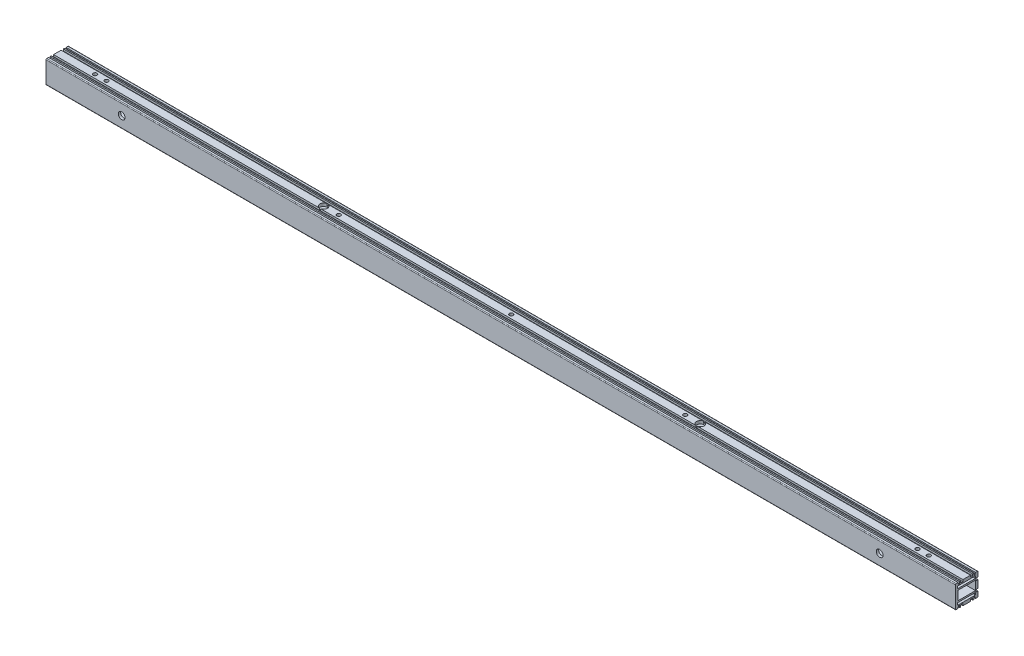
from build123d import *

# Parameters (mm, degrees)
SKETCH_1_W             = 23.5
SKETCH_1_H             = 12
EXTRUDE_1_DEPTH        = 601
HOLE_WIZARD_M6_1_D     = 5
HOLE_WIZARD_M6_1_DEPTH = 15
HOLE_WIZARD_M6_1_TIP   = 1.502151548
HOLE_WIZARD_M6_2_D     = 5
HOLE_WIZARD_M6_2_DEPTH = 15
HOLE_WIZARD_M6_2_TIP   = 1.502151548
SKETCH_8_R             = 4.5
CUT_EXTRUDE_1_DEPTH    = 602.935212461
HOLE_WIZARD_M6_3_D     = 5
HOLE_WIZARD_M6_3_DEPTH = 15
HOLE_WIZARD_M6_3_TIP   = 1.502151548
SKETCH_10_R            = 5.05
CUT_EXTRUDE_15_DEPTH   = 602.935212461
SKETCH_13_R            = 4.5
CUT_EXTRUDE_16_DEPTH   = 15
HOLE_WIZARD_M6_4_D     = 5
HOLE_WIZARD_M6_4_DEPTH = 15
HOLE_WIZARD_M6_4_TIP   = 1.502151548
HOLE_WIZARD_M6_5_D     = 5
HOLE_WIZARD_M6_5_DEPTH = 15
HOLE_WIZARD_M6_5_TIP   = 1.502151548


with BuildPart() as part:
    # 草图1 → 凸台-拉伸1 (new, symmetric)
    with BuildSketch(Plane(origin=(0, 0, 0), x_dir=(0, 0, -1), z_dir=(1, 0, 0))):
        with BuildLine():
            Line((-14, 15), (-11.5, 15))
            Line((-11.5, 15), (-11.5, 13.5))
            Line((-11.5, 13.5), (-11.4, 13.5))
            ThreePointArc((-11.4, 13.5), (-11.117157288, 13.382842712), (-11, 13.1))
            Line((-11, 13.1), (-11, 12))
            Line((-11, 12), (-9.5, 12))
            Line((-9.5, 12), (-9.5, 15))
            Line((-9.5, 15), (-8, 15))
            Line((-8, 15), (-8, 12.5))
            Line((-8, 12.5), (-5, 12.5))
            Line((-5, 12.5), (-5, 15))
            Line((-5, 15), (5, 15))
            Line((5, 15), (5, 12.5))
            Line((5, 12.5), (8, 12.5))
            Line((8, 12.5), (8, 15))
            Line((8, 15), (9.5, 15))
            Line((9.5, 15), (9.5, 12))
            Line((9.5, 12), (11, 12))
            Line((11, 12), (11, 13.1))
            ThreePointArc((11, 13.1), (11.117157288, 13.382842712), (11.4, 13.5))
            Line((11.4, 13.5), (11.5, 13.5))
            Line((11.5, 13.5), (11.5, 15))
            Line((11.5, 15), (14, 15))
            ThreePointArc((14, 15), (14.707106781, 14.707106781), (15, 14))
            Line((15, 14), (15, 8))
            Line((15, 8), (12.5, 8))
            Line((12.5, 8), (12.5, 5))
            Line((12.5, 5), (15, 5))
            Line((15, 5), (15, -5))
            Line((15, -5), (12.5, -5))
            Line((12.5, -5), (12.5, -8))
            Line((12.5, -8), (15, -8))
            Line((15, -8), (15, -14))
            ThreePointArc((15, -14), (14.707106781, -14.707106781), (14, -15))
            Line((14, -15), (11.5, -15))
            Line((11.5, -15), (11.5, -13.5))
            Line((11.5, -13.5), (11.4, -13.5))
            ThreePointArc((11.4, -13.5), (11.117157288, -13.382842712), (11, -13.1))
            Line((11, -13.1), (11, -12))
            Line((11, -12), (9.5, -12))
            Line((9.5, -12), (9.5, -15))
            Line((9.5, -15), (8, -15))
            Line((8, -15), (8, -12.5))
            Line((8, -12.5), (5, -12.5))
            Line((5, -12.5), (5, -15))
            Line((5, -15), (-5, -15))
            Line((-5, -15), (-5, -12.5))
            Line((-5, -12.5), (-8, -12.5))
            Line((-8, -12.5), (-8, -15))
            Line((-8, -15), (-9.5, -15))
            Line((-9.5, -15), (-9.5, -12))
            Line((-9.5, -12), (-11, -12))
            Line((-11, -12), (-11, -13.1))
            ThreePointArc((-11, -13.1), (-11.117157288, -13.382842712), (-11.4, -13.5))
            Line((-11.4, -13.5), (-11.5, -13.5))
            Line((-11.5, -13.5), (-11.5, -15))
            Line((-11.5, -15), (-14, -15))
            ThreePointArc((-14, -15), (-14.707106781, -14.707106781), (-15, -14))
            Line((-15, -14), (-15, 14))
            ThreePointArc((-15, 14), (-14.707106781, 14.707106781), (-14, 15))
        make_face()
        with BuildLine():
            Line((12, -10.5), (12, -8.5))
            ThreePointArc((12, -8.5), (11.853553391, -8.146446609), (11.5, -8))
            Line((11.5, -8), (-11.5, -8))
            ThreePointArc((-11.5, -8), (-11.853553391, -8.146446609), (-12, -8.5))
            Line((-12, -8.5), (-12, -10.5))
            ThreePointArc((-12, -10.5), (-11.853553391, -10.853553391), (-11.5, -11))
            Line((-11.5, -11), (11.5, -11))
            ThreePointArc((11.5, -11), (11.853553391, -10.853553391), (12, -10.5))
        make_face(mode=Mode.SUBTRACT)
        with BuildLine():
            Line((-11.5, 11), (11.5, 11))
            ThreePointArc((11.5, 11), (11.853553391, 10.853553391), (12, 10.5))
            Line((12, 10.5), (12, 8.5))
            ThreePointArc((12, 8.5), (11.853553391, 8.146446609), (11.5, 8))
            Line((11.5, 8), (-11.5, 8))
            ThreePointArc((-11.5, 8), (-11.853553391, 8.146446609), (-12, 8.5))
            Line((-12, 8.5), (-12, 10.5))
            ThreePointArc((-12, 10.5), (-11.853553391, 10.853553391), (-11.5, 11))
        make_face(mode=Mode.SUBTRACT)
        Rectangle(SKETCH_1_W, SKETCH_1_H, mode=Mode.SUBTRACT)
    extrude(amount=EXTRUDE_1_DEPTH, both=True)

    # M6 螺纹孔1
    with Locations(Plane(origin=(0, 0, -15), x_dir=(-1, 0, 0), z_dir=(0, 0, -1))):
        with Locations((-551, 0), (-536, 0), (536, 0), (551, 0)):
            Hole(HOLE_WIZARD_M6_1_D / 2, depth=HOLE_WIZARD_M6_1_DEPTH)
            with Locations((0, 0, -(HOLE_WIZARD_M6_1_DEPTH + HOLE_WIZARD_M6_1_TIP / 2))):  # 118° drill point
                Cone(0, HOLE_WIZARD_M6_1_D / 2, HOLE_WIZARD_M6_1_TIP, mode=Mode.SUBTRACT)

    # M6 螺纹孔2
    with Locations(Plane(origin=(0, 15, 0), x_dir=(-1, 0, 0), z_dir=(0, 1, 0))):
        with Locations((551, 0), (536, 0), (-536, 0), (-551, 0)):
            Hole(HOLE_WIZARD_M6_2_D / 2, depth=HOLE_WIZARD_M6_2_DEPTH)
            with Locations((0, 0, -(HOLE_WIZARD_M6_2_DEPTH + HOLE_WIZARD_M6_2_TIP / 2))):  # 118° drill point
                Cone(0, HOLE_WIZARD_M6_2_D / 2, HOLE_WIZARD_M6_2_TIP, mode=Mode.SUBTRACT)

    # 草图8 → 切除-拉伸1 (cut, through all)
    with BuildSketch(Plane.XY.offset(15)):
        with Locations((-501, 0)):
            Circle(SKETCH_8_R)
        with Locations((501, 0)):
            Circle(SKETCH_8_R)
    extrude(amount=-CUT_EXTRUDE_1_DEPTH, mode=Mode.SUBTRACT)

    # M6 螺纹孔3
    with Locations(Plane(origin=(0, 15, 0), x_dir=(-1, 0, 0), z_dir=(0, 1, 0))):
        with Locations((229, 0), (1, 0), (-229, 0)):
            Hole(HOLE_WIZARD_M6_3_D / 2, depth=HOLE_WIZARD_M6_3_DEPTH)
            with Locations((0, 0, -(HOLE_WIZARD_M6_3_DEPTH + HOLE_WIZARD_M6_3_TIP / 2))):  # 118° drill point
                Cone(0, HOLE_WIZARD_M6_3_D / 2, HOLE_WIZARD_M6_3_TIP, mode=Mode.SUBTRACT)

    # 草图10 → 切除-拉伸15 (cut, through all)
    with BuildSketch(Plane(origin=(0, 15, 0), x_dir=(-1, 0, 0), z_dir=(0, 1, 0))):
        with Locations(Location((249, 0, 0), (0, 0, 90))):
            Circle(SKETCH_10_R)
        with Locations(Location((-249, 0, 0), (0, 0, 90))):
            Circle(SKETCH_10_R)
    extrude(amount=-CUT_EXTRUDE_15_DEPTH, mode=Mode.SUBTRACT)

    # 草图13 → 切除-拉伸16 (cut)
    with BuildSketch(Plane.XZ.offset(15)):
        with Locations(Location((229, 0, 0), (0, 0, 90))):
            Circle(SKETCH_13_R)
        with Locations(Location((-1, 0, 0), (0, 0, 90))):
            Circle(SKETCH_13_R)
        with Locations(Location((-229, 0, 0), (0, 0, 90))):
            Circle(SKETCH_13_R)
    extrude(amount=-CUT_EXTRUDE_16_DEPTH, mode=Mode.SUBTRACT)

    # M6 螺纹孔4
    with Locations(Plane(origin=(0, 0, -15), x_dir=(-1, 0, 0), z_dir=(0, 0, -1))):
        with Locations((341, 0), (281, 0), (-281, 0), (-341, 0)):
            Hole(HOLE_WIZARD_M6_4_D / 2, depth=HOLE_WIZARD_M6_4_DEPTH)
            with Locations((0, 0, -(HOLE_WIZARD_M6_4_DEPTH + HOLE_WIZARD_M6_4_TIP / 2))):  # 118° drill point
                Cone(0, HOLE_WIZARD_M6_4_D / 2, HOLE_WIZARD_M6_4_TIP, mode=Mode.SUBTRACT)

    # M6 螺纹孔5
    with Locations(Plane(origin=(0, 0, -15), x_dir=(-1, 0, 0), z_dir=(0, 0, -1))):
        with Locations((446, 0), (376, 0)):
            Hole(HOLE_WIZARD_M6_5_D / 2, depth=HOLE_WIZARD_M6_5_DEPTH)
            with Locations((0, 0, -(HOLE_WIZARD_M6_5_DEPTH + HOLE_WIZARD_M6_5_TIP / 2))):  # 118° drill point
                Cone(0, HOLE_WIZARD_M6_5_D / 2, HOLE_WIZARD_M6_5_TIP, mode=Mode.SUBTRACT)


solid = part.part
